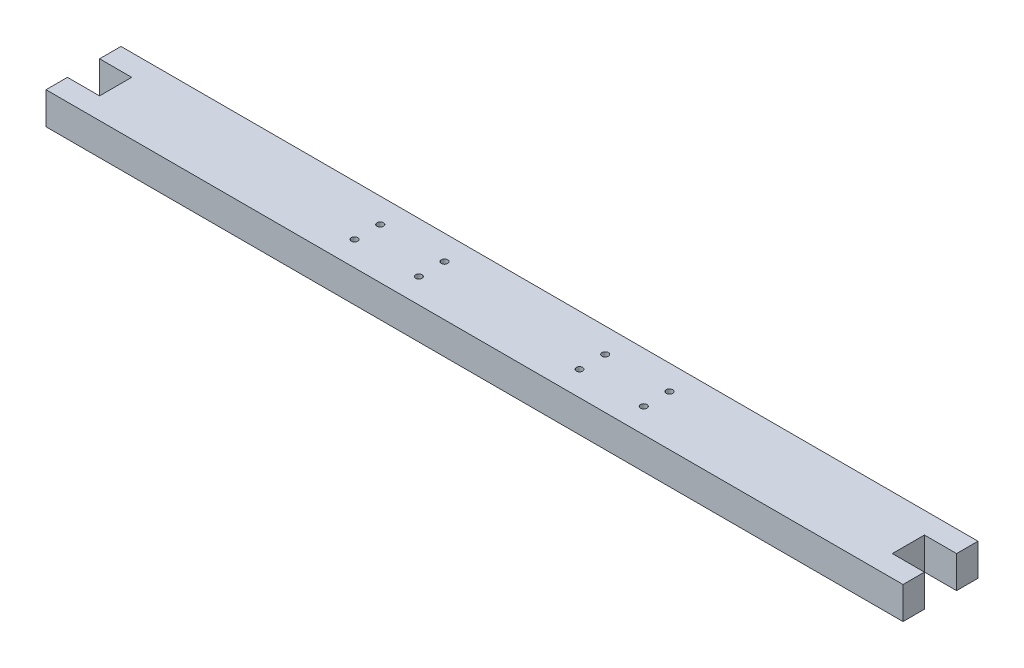
from build123d import *

# Parameters (mm, degrees)
EXTRUDE_1_DEPTH     = 15
SKETCH_4_R          = 1.5
CUT_EXTRUDE_1_DEPTH = 15


with BuildPart() as part:
    # 草图3 → 凸台-拉伸1 (new body)
    with BuildSketch(Plane(origin=(0, 0, 0), x_dir=(1, 0, 0), z_dir=(0, 1, 0))):
        Polygon((0, 0), (400, 0), (400, 10), (385, 10), (385, 25), (400, 25), (400, 35), (0, 35), (0, 25), (15, 25), (15, 10), (0, 10), align=None)
    extrude(amount=EXTRUDE_1_DEPTH)

    # 草图4 → 切除-拉伸1 (cut)
    with BuildSketch(Plane(origin=(0, 15, 0), x_dir=(1, 0, 0), z_dir=(0, 1, 0))):
        with Locations(Location((267.5, 11.5, 0), (0, 0, 270))):
            Circle(SKETCH_4_R)
        with Locations(Location((267.5, 23.5, 0), (0, 0, 270))):
            Circle(SKETCH_4_R)
        with Locations(Location((237.5, 11.5, 0), (0, 0, 270))):
            Circle(SKETCH_4_R)
        with Locations(Location((237.5, 23.5, 0), (0, 0, 270))):
            Circle(SKETCH_4_R)
        with Locations(Location((162.5, 11.5, 0), (0, 0, 270))):
            Circle(SKETCH_4_R)
        with Locations(Location((132.5, 11.5, 0), (0, 0, 270))):
            Circle(SKETCH_4_R)
        with Locations(Location((132.5, 23.5, 0), (0, 0, 270))):
            Circle(SKETCH_4_R)
        with Locations(Location((162.5, 23.5, 0), (0, 0, 270))):
            Circle(SKETCH_4_R)
    extrude(amount=-CUT_EXTRUDE_1_DEPTH, mode=Mode.SUBTRACT)


solid = part.part
